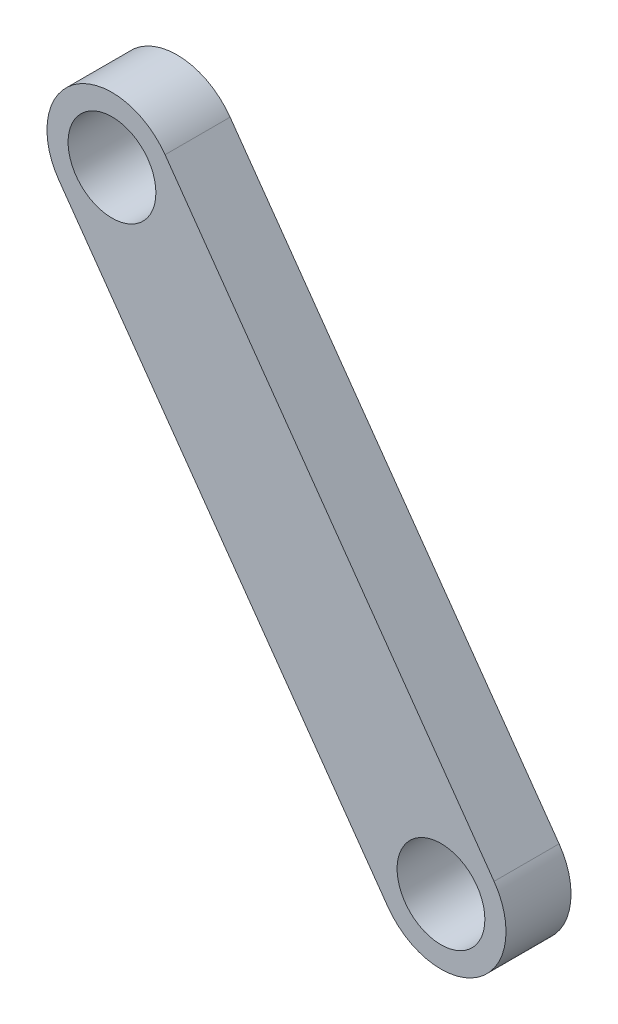
from build123d import *

# Parameters (mm, degrees)
SKETCH1_R           = 2.7
BOSS_EXTRUDE1_DEPTH = 4


with BuildPart() as part:
    # Sketch1 → Boss-Extrude1 (new body)
    with BuildSketch(Plane.XY):
        with BuildLine():
            Line((-16.972753507, 30.902518279), (3.264890397, 2.310950172))
            ThreePointArc((3.264890397, 2.310950172), (2.310950172, -3.264890397), (-3.264890397, -2.310950172))
            Line((-3.264890397, -2.310950172), (-23.5025343, 26.280617935))
            ThreePointArc((-23.5025343, 26.280617935), (-22.548594075, 31.856458504), (-16.972753507, 30.902518279))
        make_face()
        Circle(SKETCH1_R, mode=Mode.SUBTRACT)
        with Locations((-20.237643903, 28.591568107)):
            Circle(SKETCH1_R, mode=Mode.SUBTRACT)
    extrude(amount=BOSS_EXTRUDE1_DEPTH)


solid = part.part
